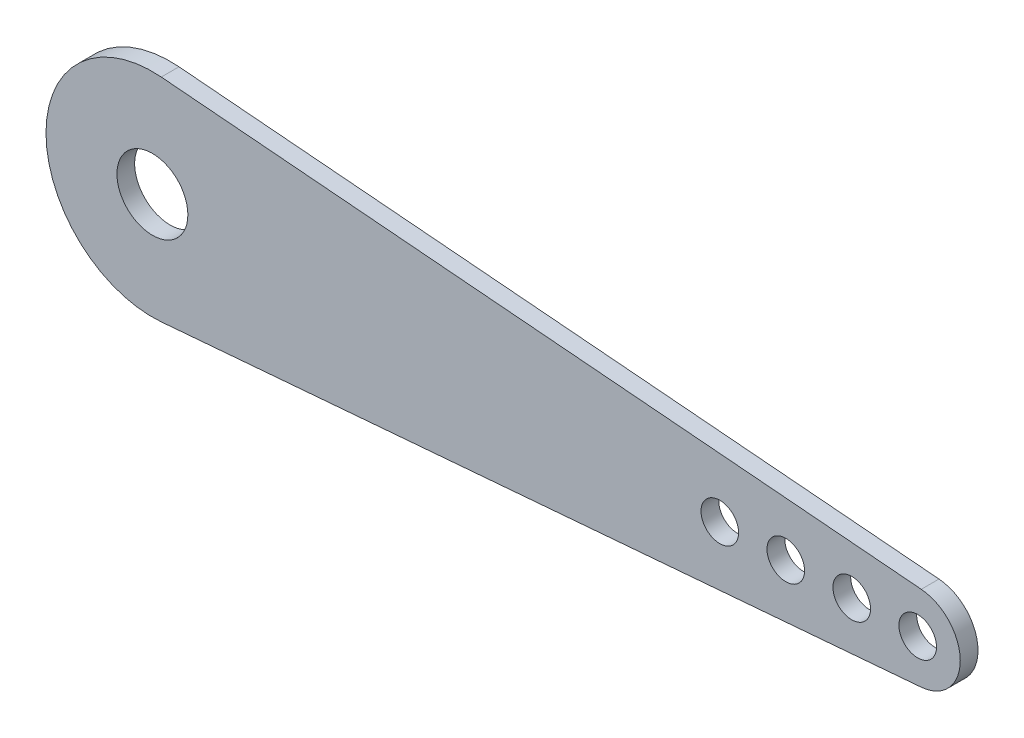
from build123d import *

# Parameters (mm, degrees)
FLAT_SKETCH_R           = 19.05
FLAT_SKETCH_R_2         = 6.35
FLAT_SKETCH_R_3         = 7.62
FLAT_SKETCH_R_4         = 3.3655
EXTRUDE_FACE_DEPTH      = 3.175
FLAT_SKETCH_4_R         = 3.3655
EXTRUDE_CUT_HOLES_DEPTH = 3.175


with BuildPart() as part:
    # Flat sketch → Extrude face (new body)
    # profile 1 of 7: a face of its own
    with BuildSketch(Plane.XY):
        Circle(FLAT_SKETCH_R)
        Circle(FLAT_SKETCH_R_2, mode=Mode.SUBTRACT)
    # profile 2 of 7: a face of its own
    with BuildSketch(Plane.XY):
        with Locations((137.033, 0)):
            Circle(FLAT_SKETCH_R_3)
        with Locations((137.033, 0)):
            Circle(FLAT_SKETCH_R_4, mode=Mode.SUBTRACT)
    # profile 3 of 7: a face of its own
    with BuildSketch(Plane.XY):
        with Locations((137.033, 0)):
            Circle(FLAT_SKETCH_R_4)
    # profile 4 of 7: a face of its own
    with BuildSketch(Plane.XY):
        with BuildLine():
            Line((137.668588508, 7.593446335), (1.58897127, 18.983615839))
            ThreePointArc((1.58897127, 18.983615839), (14.020920132, 12.896367654), (19.05, 0))
            ThreePointArc((19.05, 0), (14.020920132, -12.896367654), (1.58897127, -18.983615839))
            Line((1.58897127, -18.983615839), (137.668588508, -7.593446335))
            ThreePointArc((137.668588508, -7.593446335), (129.413, 0), (137.668588508, 7.593446335))
        make_face()
        with Locations((101.6, 0)):
            Circle(FLAT_SKETCH_R_4, mode=Mode.SUBTRACT)
        with Locations((113.411, 0)):
            Circle(FLAT_SKETCH_R_4, mode=Mode.SUBTRACT)
        with Locations((125.222, 0)):
            Circle(FLAT_SKETCH_R_4, mode=Mode.SUBTRACT)
    # profile 5 of 7: a face of its own
    with BuildSketch(Plane.XY):
        with Locations((125.222, 0)):
            Circle(FLAT_SKETCH_R_4)
    # profile 6 of 7: a face of its own
    with BuildSketch(Plane.XY):
        with Locations((113.411, 0)):
            Circle(FLAT_SKETCH_R_4)
    # profile 7 of 7: a face of its own
    with BuildSketch(Plane.XY):
        with Locations((101.6, 0)):
            Circle(FLAT_SKETCH_R_4)
    extrude(amount=EXTRUDE_FACE_DEPTH)

    # Flat sketch<4> → Extrude cut - holes (cut)
    with BuildSketch(Plane.XY):
        with Locations((137.033, 0)):
            Circle(FLAT_SKETCH_4_R)
        with Locations((125.222, 0)):
            Circle(FLAT_SKETCH_4_R)
        with Locations((113.411, 0)):
            Circle(FLAT_SKETCH_4_R)
        with Locations((101.6, 0)):
            Circle(FLAT_SKETCH_4_R)
    extrude(amount=EXTRUDE_CUT_HOLES_DEPTH, mode=Mode.SUBTRACT)


solid = part.part
